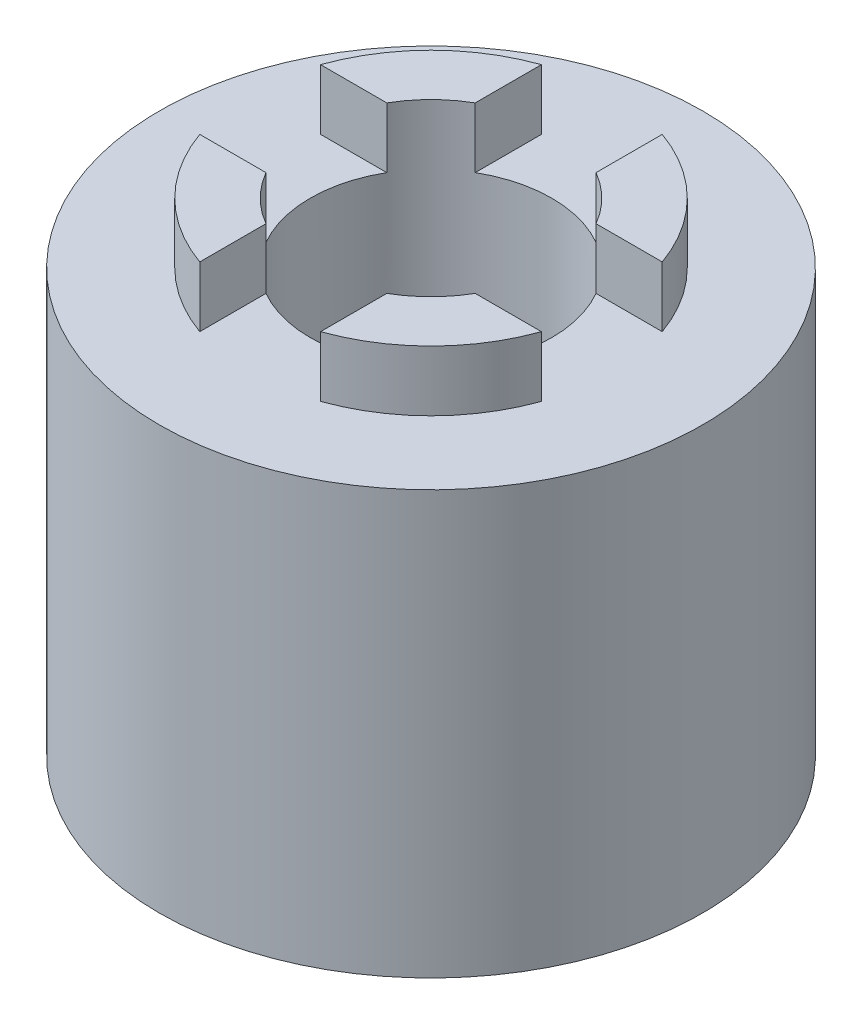
from build123d import *

# Parameters (mm, degrees)
SKETCH2_R           = 28.575
SKETCH2_R_2         = 12.7
BOSS_EXTRUDE2_DEPTH = 50.8
SKETCH4_W           = 76.2
SKETCH4_H           = 12.7
CUT_EXTRUDE7_DEPTH  = 6.35
CIRPATTERN1_COUNT   = 2
CIRPATTERN1_ANGLE   = 90
SKETCH9_R           = 22.225
CUT_EXTRUDE8_DEPTH  = 25.4
CUT_EXTRUDE10_START = -6.35
SKETCH10_R          = 28.575
SKETCH10_R_2        = 19.05
CUT_EXTRUDE10_DEPTH = 6.35


with BuildPart() as part:
    # Sketch2 → Boss-Extrude2 (new body)
    with BuildSketch(Plane(origin=(0, 0, 0), x_dir=(1, 0, 0), z_dir=(0, 1, 0))):
        with Locations(Location((0, 0, 0), (0, 0, 270))):
            Circle(SKETCH2_R)
        with Locations(Location((0, 0, 0), (0, 0, 270))):
            Circle(SKETCH2_R_2, mode=Mode.SUBTRACT)
    extrude(amount=BOSS_EXTRUDE2_DEPTH)

    # Sketch4 → Cut-Extrude7 (cut)
    with BuildSketch(Plane(origin=(0, 50.8, 0), x_dir=(1, 0, 0), z_dir=(0, 1, 0))):
        Rectangle(SKETCH4_W, SKETCH4_H)
    cut_extrude7 = extrude(amount=-CUT_EXTRUDE7_DEPTH, mode=Mode.SUBTRACT)

    # CirPattern1: Cut-Extrude7 ×2 about axis
    cirpattern1_axis = Axis((0, 50.8, 0), (0, 1, 0))
    for i in range(1, CIRPATTERN1_COUNT):
        add(cut_extrude7.rotate(cirpattern1_axis, i * CIRPATTERN1_ANGLE / (CIRPATTERN1_COUNT - 1)), mode=Mode.SUBTRACT)

    # Sketch9 → Cut-Extrude8 (cut)
    with BuildSketch(Plane.XZ):
        with Locations(Location((0, 0, 0), (0, 0, 270))):
            Circle(SKETCH9_R)
    extrude(amount=-CUT_EXTRUDE8_DEPTH, mode=Mode.SUBTRACT)

    # Sketch10 → Cut-Extrude10 (cut)
    with BuildSketch(Plane(origin=(0, 50.8, 0), x_dir=(1, 0, 0), z_dir=(0, 1, 0)).offset(CUT_EXTRUDE10_START)):
        with Locations(Location((0, 0, 0), (0, 0, 90))):
            Circle(SKETCH10_R)
        Circle(SKETCH10_R_2, mode=Mode.SUBTRACT)
    extrude(amount=CUT_EXTRUDE10_DEPTH, mode=Mode.SUBTRACT)


solid = part.part
